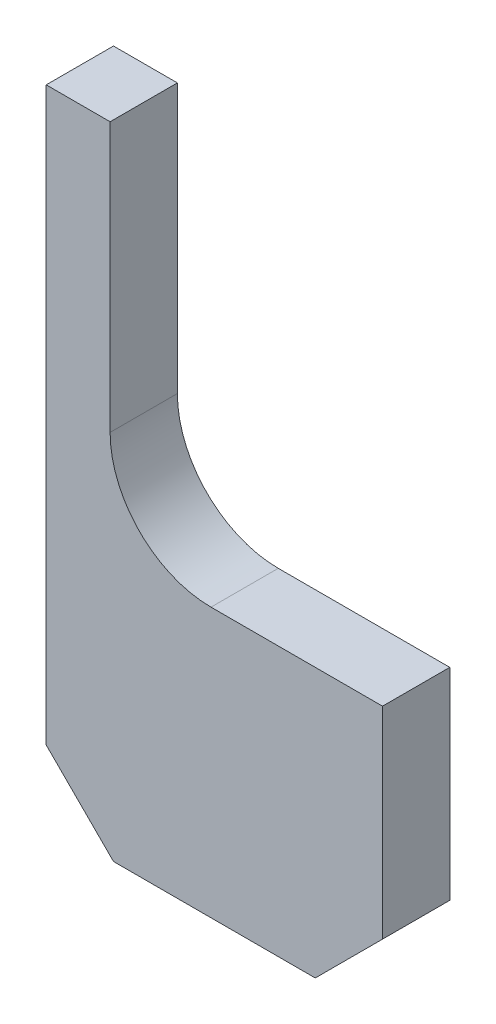
from build123d import *

# Parameters (mm, degrees)
EXTRUDE_1_DEPTH = 20
CHAMFER_1_SIZE  = 20


with BuildPart() as part:
    # 草图1 → 凸台-拉伸1 (new body)
    with BuildSketch(Plane.XY):
        with BuildLine():
            Line((0, 0), (19, 0))
            Line((19, 0), (19, -80))
            ThreePointArc((19, -80), (27.786796564, -101.213203436), (49, -110))
            Line((49, -110), (100, -110))
            Line((100, -110), (100, -190))
            Line((100, -190), (0, -190))
            Line((0, -190), (0, 0))
        make_face()
    extrude(amount=EXTRUDE_1_DEPTH)

    # 倒角1
    chamfer_1_edges = [part.edges().sort_by_distance(p)[0] for p in [
        (100, -190, 10),
        (0, -190, 10),
    ]]
    chamfer(chamfer_1_edges, length=CHAMFER_1_SIZE)


solid = part.part
